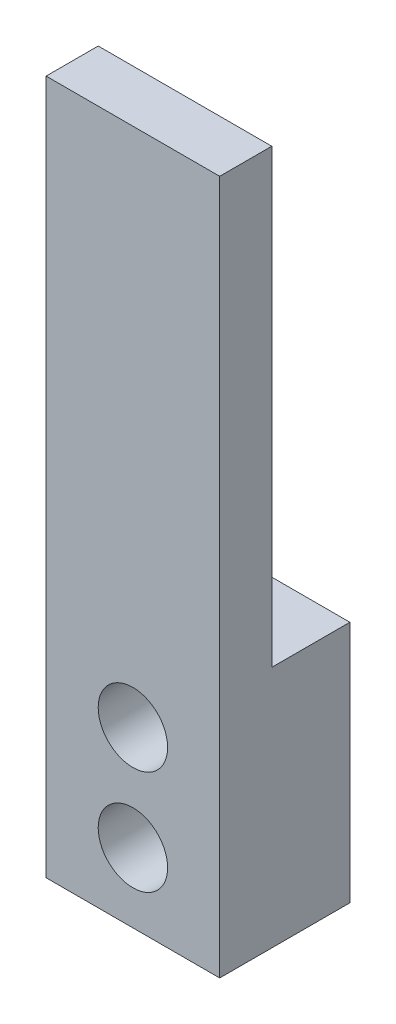
from build123d import *

# Parameters (mm, degrees)
SKETCH2_W      = 5
SKETCH2_H      = 20
EXTRUDE1_DEPTH = 3.75
SKETCH3_W      = 5
SKETCH3_H      = 13
EXTRUDE2_DEPTH = 2.25
SKETCH4_R      = 1
EXTRUDE3_DEPTH = 3.75


with BuildPart() as part:
    # Sketch2 → Extrude1 (new body)
    with BuildSketch(Plane.XY):
        with Locations((0, -10)):
            Rectangle(SKETCH2_W, SKETCH2_H)
    extrude(amount=EXTRUDE1_DEPTH)

    # Sketch3 → Extrude2 (cut)
    with BuildSketch(Plane(origin=(0, 0, 0), x_dir=(-1, 0, 0), z_dir=(0, 0, -1))):
        with Locations((0, -6.5)):
            Rectangle(SKETCH3_W, SKETCH3_H)
    extrude(amount=-EXTRUDE2_DEPTH, mode=Mode.SUBTRACT)

    # Sketch4 → Extrude3 (cut)
    with BuildSketch(Plane(origin=(0, 0, 0), x_dir=(-1, 0, 0), z_dir=(0, 0, -1))):
        with Locations((0, -18)):
            Circle(SKETCH4_R)
        with Locations((0, -15)):
            Circle(SKETCH4_R)
    extrude(amount=-EXTRUDE3_DEPTH, mode=Mode.SUBTRACT)


solid = part.part
